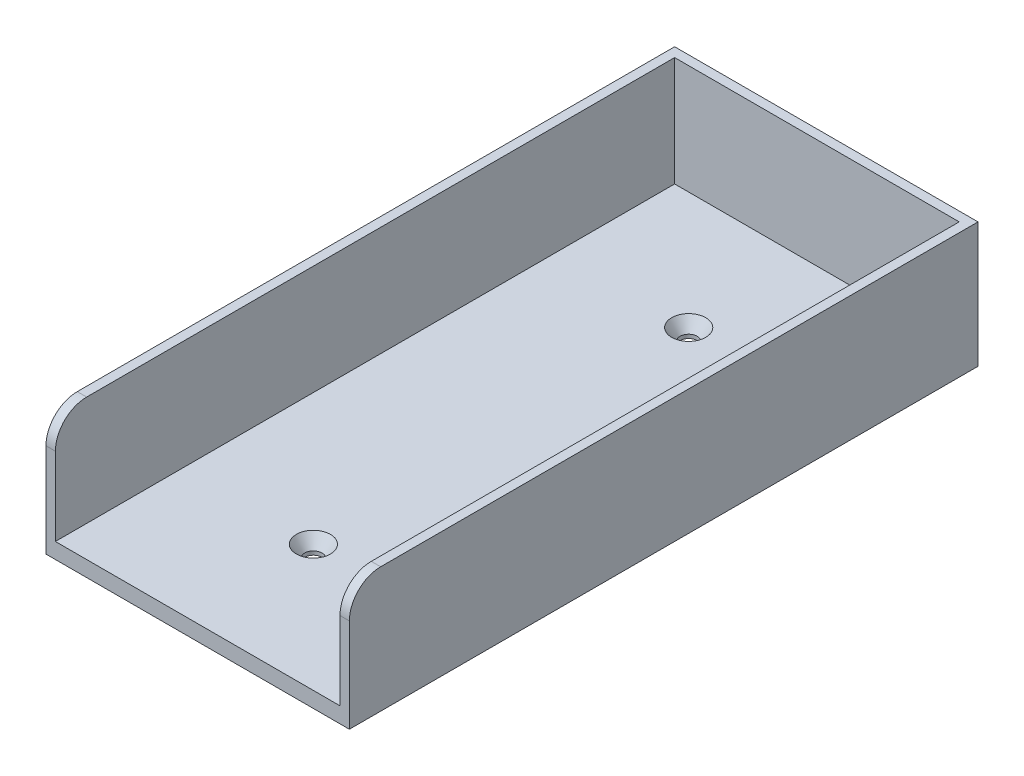
from build123d import *

# Parameters (mm, degrees)
BOSS_EXTRUDE1_DEPTH = 35
SKETCH3_W           = 97
SKETCH3_H           = 201
BOSS_EXTRUDE2_DEPTH = 5
FILLET1_R           = 10
SKETCH4_R           = 2.75
CUT_EXTRUDE1_DEPTH  = 10
CHAMFER3_SIZE       = 2.7
CHAMFER3_SIZE2      = 3.8
CHAMFER4_SIZE       = 2.7
CHAMFER4_SIZE2      = 3.8


with BuildPart() as part:
    # Sketch1 → Boss-Extrude1 (new body)
    with BuildSketch(Plane(origin=(0, 0, 0), x_dir=(1, 0, 0), z_dir=(0, 1, 0))):
        Polygon((-45.5, -97.5), (-45.5, -100.5), (-48.5, -100.5), (-48.5, 100.5), (48.5, 100.5), (48.5, -100.5), (45.5, -100.5), (45.5, -97.5), (45.5, 97.5), (-45.5, 97.5), align=None)
    extrude(amount=BOSS_EXTRUDE1_DEPTH)

    # Sketch3 → Boss-Extrude2 (add)
    with BuildSketch(Plane.XZ):
        Rectangle(SKETCH3_W, SKETCH3_H)
    extrude(amount=BOSS_EXTRUDE2_DEPTH)

    # Fillet1
    fillet1_edges = [part.edges().sort_by_distance(p)[0] for p in [
        (47, 35, 100.5),
        (-47, 35, 100.5),
    ]]
    fillet(fillet1_edges, radius=FILLET1_R)

    # Sketch4 → Cut-Extrude1 (cut)
    with BuildSketch(Plane(origin=(0, 0, 0), x_dir=(1, 0, 0), z_dir=(0, 1, 0))):
        with Locations(Location((-3.5, 60, 0), (0, 0, 270))):
            Circle(SKETCH4_R)
        with Locations(Location((-3.5, -60, 0), (0, 0, 270))):
            Circle(SKETCH4_R)
    extrude(amount=-CUT_EXTRUDE1_DEPTH, mode=Mode.SUBTRACT)

    # Chamfer3
    chamfer3_edges = [part.edges().sort_by_distance(p)[0] for p in [
        (-3.5, 0, 57.25),
    ]]
    chamfer3_side = [part.faces().sort_by_distance(p)[0] for p in [
        (0.009254512, 0, 1.50396622),
    ]]
    chamfer(chamfer3_edges, length=CHAMFER3_SIZE, length2=CHAMFER3_SIZE2, reference=chamfer3_side[0])

    # Chamfer4
    chamfer4_edges = [part.edges().sort_by_distance(p)[0] for p in [
        (-3.5, 0, -62.75),
    ]]
    chamfer4_side = [part.faces().sort_by_distance(p)[0] for p in [
        (0.022889878, 0, 1.276677255),
    ]]
    chamfer(chamfer4_edges, length=CHAMFER4_SIZE, length2=CHAMFER4_SIZE2, reference=chamfer4_side[0])


solid = part.part
